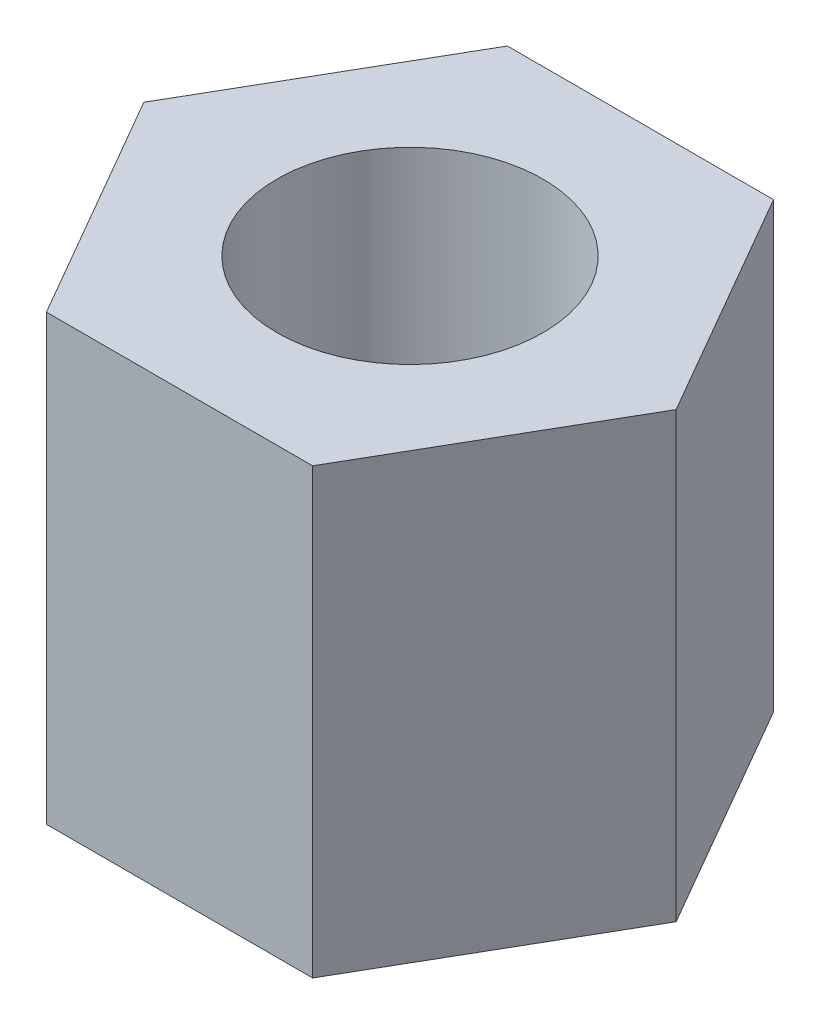
from build123d import *

# Parameters (mm, degrees)
SKETCH_1_R      = 3
EXTRUDE_1_DEPTH = 10


with BuildPart() as part:
    # 草图1 → 凸台-拉伸1 (new body)
    with BuildSketch(Plane(origin=(0, 0, 0), x_dir=(1, 0, 0), z_dir=(0, 1, 0))):
        Polygon((-6, 0), (-3, -5.196152423), (3, -5.196152423), (6, 0), (3, 5.196152423), (-3, 5.196152423), align=None)
        with Locations(Location((0, 0, 0), (0, 0, 270))):
            Circle(SKETCH_1_R, mode=Mode.SUBTRACT)
    extrude(amount=EXTRUDE_1_DEPTH)


solid = part.part
